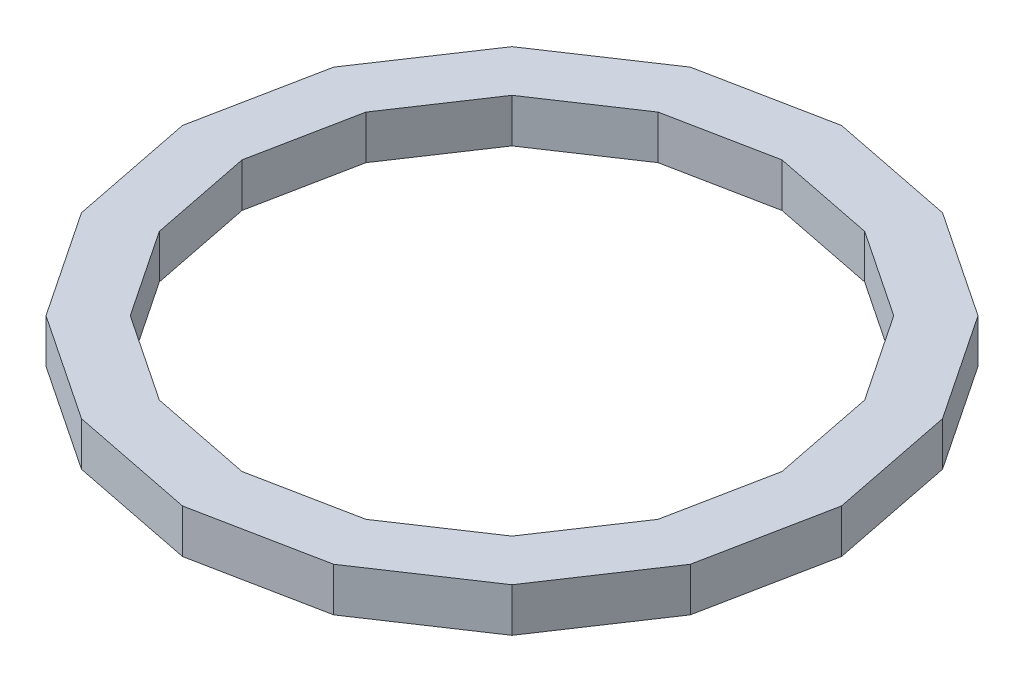
from build123d import *

# Parameters (mm, degrees)
BOSS_EXTRUDE1_DEPTH = 19.05


with BuildPart() as part:
    # Sketch1 → Boss-Extrude1 (new body)
    with BuildSketch(Plane(origin=(0, 0, 0), x_dir=(1, 0, 0), z_dir=(0, 1, 0))):
        Polygon((143.21571522, 0), (132.314068026, 54.806281469), (101.268803404, 101.268803404), (54.806281469, 132.314068026), (0, 143.21571522), (-54.806281469, 132.314068026), (-101.268803404, 101.268803404), (-132.314068026, 54.806281469), (-143.21571522, 0), (-132.314068026, -54.806281469), (-101.268803404, -101.268803404), (-54.806281469, -132.314068026), (0, -143.21571522), (54.806281469, -132.314068026), (101.268803404, -101.268803404), (132.314068026, -54.806281469), align=None)
        Polygon((117.318099801, 0), (108.3877912, 44.895693111), (82.956423925, 82.956423925), (44.895693111, 108.3877912), (0, 117.318099801), (-44.895693111, 108.3877912), (-82.956423925, 82.956423925), (-108.3877912, 44.895693111), (-117.318099801, 0), (-108.3877912, -44.895693111), (-82.956423925, -82.956423925), (-44.895693111, -108.3877912), (0, -117.318099801), (44.895693111, -108.3877912), (82.956423925, -82.956423925), (108.3877912, -44.895693111), align=None, mode=Mode.SUBTRACT)
    extrude(amount=BOSS_EXTRUDE1_DEPTH)


solid = part.part
